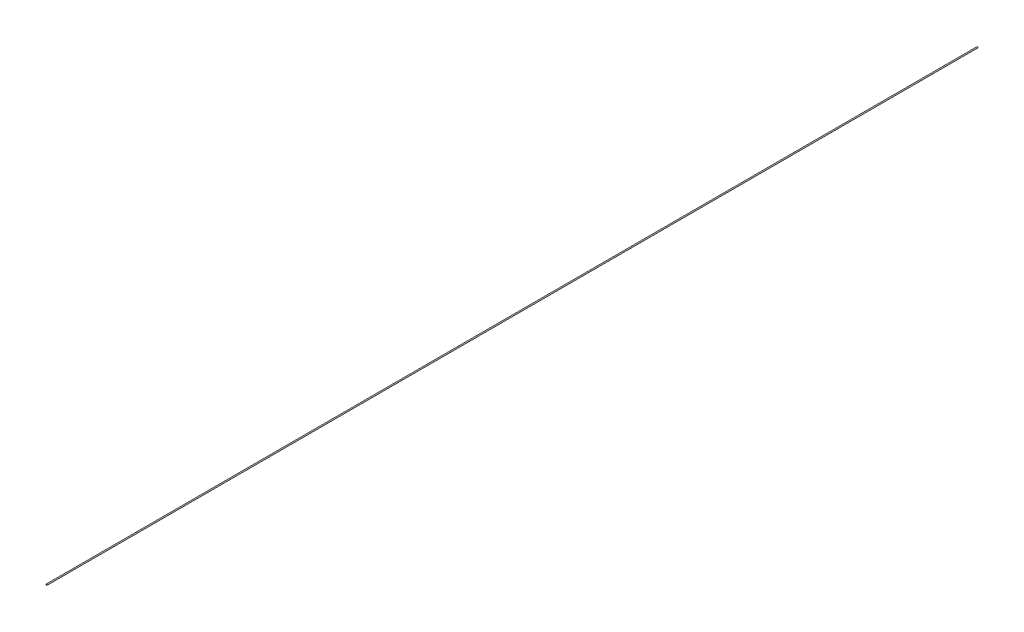
from build123d import *

# Parameters (mm, degrees)
SKETCH_2_R      = 0.6
EXTRUDE_1_DEPTH = 1012.19


with BuildPart() as part:
    # 草图2 → 凸台-拉伸1 (new body)
    with BuildSketch(Plane.XY):
        Circle(SKETCH_2_R)
    extrude(amount=EXTRUDE_1_DEPTH)


solid = part.part
